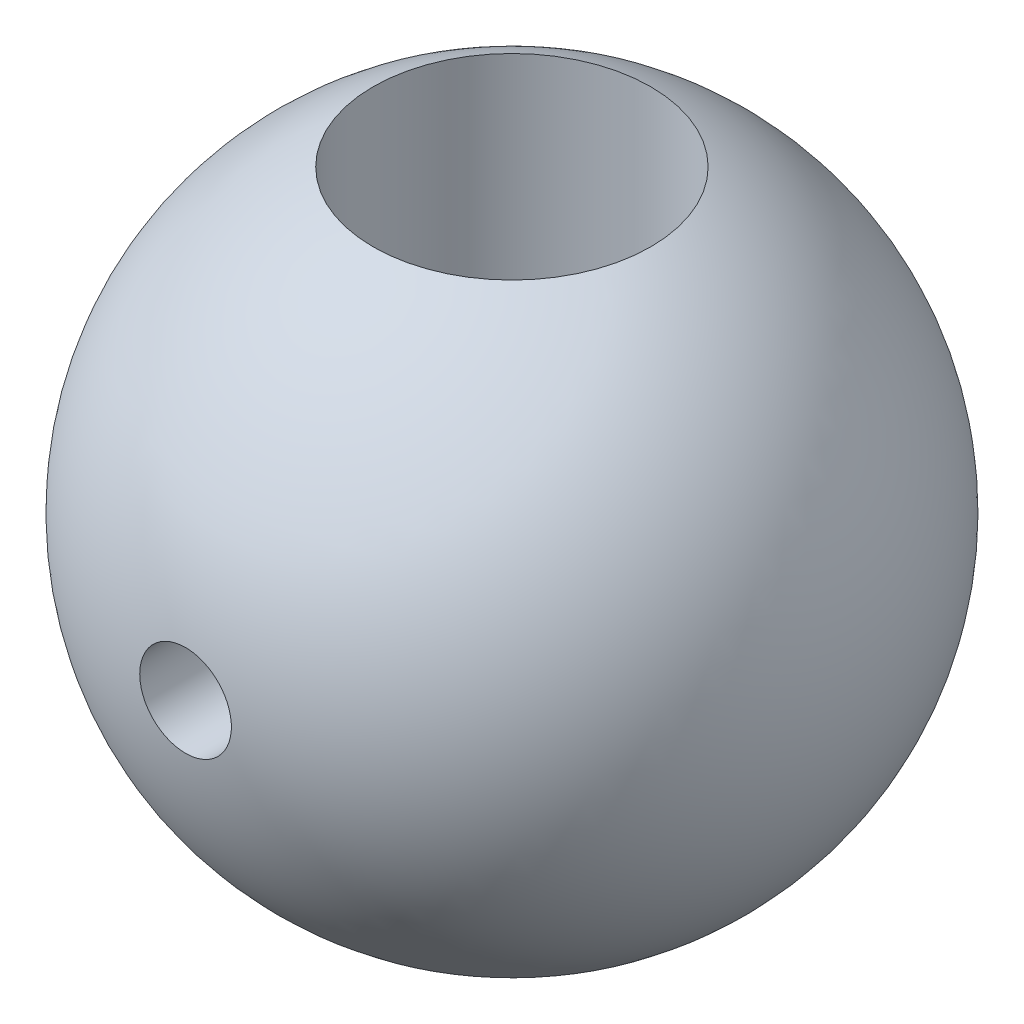
from build123d import *

# Parameters (mm, degrees)
CORTAR_EXTRUIR1_DEPTH      = 17.454482672
CORTAR_EXTRUIR1_DEPTH_BACK = 10
CROQUIS2_R                 = 4
CROQUIS4_W                 = 1.3208
CROQUIS4_H                 = 9.5


with BuildPart() as part:
    # Croquis1 → Revolución1 (revolve)
    with BuildSketch(Plane.XY):
        with BuildLine():
            Line((0, -9.5), (0, 9.5))
            ThreePointArc((0, 9.5), (9.5, 0), (0, -9.5))
        make_face()
    revolve(axis=Axis((0, -9.5, 0), (0, 1, 0)))

    # Croquis2 → Cortar-Extruir1 (cut, two sides: drawn at the far end of the back side and taken through both)
    with BuildSketch(Plane(origin=(0, 0, 0), x_dir=(1, 0, 0), z_dir=(0, 1, 0)).offset(-CORTAR_EXTRUIR1_DEPTH_BACK)):
        with Locations(Location((0, 0, 0), (0, 0, 180))):
            Circle(CROQUIS2_R)
    extrude(amount=CORTAR_EXTRUIR1_DEPTH + CORTAR_EXTRUIR1_DEPTH_BACK, mode=Mode.SUBTRACT)

    # Croquis4 → Diámetro de taladro #37 (0.104)1 (revolve, cut)
    with BuildSketch(Plane.YZ):
        with Locations((0.6604, 4.75)):
            Rectangle(CROQUIS4_W, CROQUIS4_H)
    revolve(axis=Axis((0, 0, -6.35), (0, 0, 1)), mode=Mode.SUBTRACT)


solid = part.part
